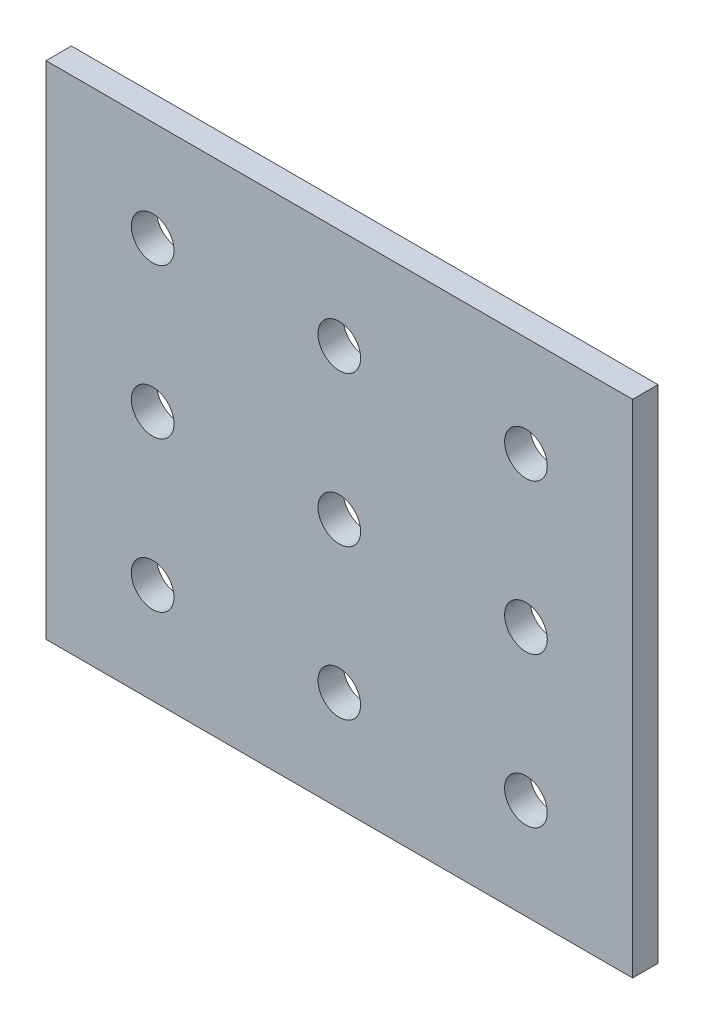
from build123d import *

# Parameters (mm, degrees)
CROQUIS1_W               = 90
CROQUIS1_H               = 76.2
CROQUIS1_R               = 4
SALIENTE_EXTRUIR1_DEPTH  = 0.47625
CROQUIS1_2_W             = 90
CROQUIS1_2_H             = 76.2
CROQUIS1_2_R             = 4
SALIENTE_EXTRUIR2_DEPTH  = 4.7625
CROQUIS3_W               = 90
CROQUIS3_H               = 4.7625
SALIENTE_EXTRUIR3_DEPTH  = 4.445
CROQUIS5_W               = 90
CROQUIS5_H               = 4.7625
SALIENTE_EXTRUIR4_DEPTH  = 4.445
CROQUIS6_W               = 4.7625
CROQUIS6_H               = 85.09
SALIENTE_EXTRUIR5_DEPTH  = 5
CROQUIS7_W               = 4.7625
CROQUIS7_H               = 85.09
SALIENTE_EXTRUIR6_DEPTH  = 5
CROQUIS8_W               = 100
CROQUIS8_H               = 4.7625
SALIENTE_EXTRUIR7_DEPTH  = 4.445
CROQUIS9_W               = 100
CROQUIS9_H               = 4.7625
SALIENTE_EXTRUIR8_DEPTH  = 4.445
CROQUIS10_W              = 4.7625
CROQUIS10_H              = 93.98
SALIENTE_EXTRUIR9_DEPTH  = 5
CROQUIS12_W              = 4.7625
CROQUIS12_H              = 93.98
SALIENTE_EXTRUIR10_DEPTH = 5


with BuildPart() as part:
    # Croquis1 → Saliente-Extruir1 (new body)
    with BuildSketch(Plane.XY):
        with Locations((45, 38.1)):
            Rectangle(CROQUIS1_W, CROQUIS1_H)
        with Locations((45, 38.1)):
            Circle(CROQUIS1_R, mode=Mode.SUBTRACT)
        with Locations((10, 9.95)):
            Circle(CROQUIS1_R, mode=Mode.SUBTRACT)
        with Locations((10, 66.25)):
            Circle(CROQUIS1_R, mode=Mode.SUBTRACT)
        with Locations((80, 66.25)):
            Circle(CROQUIS1_R, mode=Mode.SUBTRACT)
        with Locations((80, 9.95)):
            Circle(CROQUIS1_R, mode=Mode.SUBTRACT)
        with Locations((45, 66.25)):
            Circle(CROQUIS1_R, mode=Mode.SUBTRACT)
        with Locations((10, 38.1)):
            Circle(CROQUIS1_R, mode=Mode.SUBTRACT)
        with Locations((80, 38.1)):
            Circle(CROQUIS1_R, mode=Mode.SUBTRACT)
        with Locations((45, 9.95)):
            Circle(CROQUIS1_R, mode=Mode.SUBTRACT)
    extrude(amount=SALIENTE_EXTRUIR1_DEPTH)

    # Croquis1<2> → Saliente-Extruir2 (add)
    with BuildSketch(Plane.XY):
        with Locations((45, 38.1)):
            Rectangle(CROQUIS1_2_W, CROQUIS1_2_H)
        with Locations((45, 38.1)):
            Circle(CROQUIS1_2_R, mode=Mode.SUBTRACT)
        with Locations((10, 9.95)):
            Circle(CROQUIS1_2_R, mode=Mode.SUBTRACT)
        with Locations((10, 66.25)):
            Circle(CROQUIS1_2_R, mode=Mode.SUBTRACT)
        with Locations((80, 66.25)):
            Circle(CROQUIS1_2_R, mode=Mode.SUBTRACT)
        with Locations((80, 9.95)):
            Circle(CROQUIS1_2_R, mode=Mode.SUBTRACT)
        with Locations((45, 66.25)):
            Circle(CROQUIS1_2_R, mode=Mode.SUBTRACT)
        with Locations((10, 38.1)):
            Circle(CROQUIS1_2_R, mode=Mode.SUBTRACT)
        with Locations((80, 38.1)):
            Circle(CROQUIS1_2_R, mode=Mode.SUBTRACT)
        with Locations((45, 9.95)):
            Circle(CROQUIS1_2_R, mode=Mode.SUBTRACT)
    extrude(amount=SALIENTE_EXTRUIR2_DEPTH)

    # Croquis3 → Saliente-Extruir3 (add)
    with BuildSketch(Plane.XZ):
        with Locations((45, 2.38125)):
            Rectangle(CROQUIS3_W, CROQUIS3_H)
    extrude(amount=SALIENTE_EXTRUIR3_DEPTH)

    # Croquis5 → Saliente-Extruir4 (add)
    with BuildSketch(Plane(origin=(0, 76.2, 0), x_dir=(1, 0, 0), z_dir=(0, 1, 0))):
        with Locations((45, -2.38125)):
            Rectangle(CROQUIS5_W, CROQUIS5_H)
    extrude(amount=SALIENTE_EXTRUIR4_DEPTH)

    # Croquis6 → Saliente-Extruir5 (add)
    with BuildSketch(Plane.ZY):
        with Locations((2.38125, 38.1)):
            Rectangle(CROQUIS6_W, CROQUIS6_H)
    extrude(amount=SALIENTE_EXTRUIR5_DEPTH)

    # Croquis7 → Saliente-Extruir6 (add)
    with BuildSketch(Plane(origin=(90, 0, 0), x_dir=(0, 0, -1), z_dir=(1, 0, 0))):
        with Locations((-2.38125, 38.1)):
            Rectangle(CROQUIS7_W, CROQUIS7_H)
    extrude(amount=SALIENTE_EXTRUIR6_DEPTH)

    # Croquis8 → Saliente-Extruir7 (add)
    with BuildSketch(Plane.XZ.offset(4.445)):
        with Locations((45, 2.38125)):
            Rectangle(CROQUIS8_W, CROQUIS8_H)
    extrude(amount=SALIENTE_EXTRUIR7_DEPTH)

    # Croquis9 → Saliente-Extruir8 (add)
    with BuildSketch(Plane(origin=(0, 80.645, 0), x_dir=(1, 0, 0), z_dir=(0, 1, 0))):
        with Locations((45, -2.38125)):
            Rectangle(CROQUIS9_W, CROQUIS9_H)
    extrude(amount=SALIENTE_EXTRUIR8_DEPTH)

    # Croquis10 → Saliente-Extruir9 (add)
    with BuildSketch(Plane(origin=(95, 0, 0), x_dir=(0, 0, -1), z_dir=(1, 0, 0))):
        with Locations((-2.38125, 38.1)):
            Rectangle(CROQUIS10_W, CROQUIS10_H)
    extrude(amount=SALIENTE_EXTRUIR9_DEPTH)

    # Croquis12 → Saliente-Extruir10 (add)
    with BuildSketch(Plane.ZY.offset(5)):
        with Locations((2.38125, 38.1)):
            Rectangle(CROQUIS12_W, CROQUIS12_H)
    extrude(amount=SALIENTE_EXTRUIR10_DEPTH)


solid = part.part
